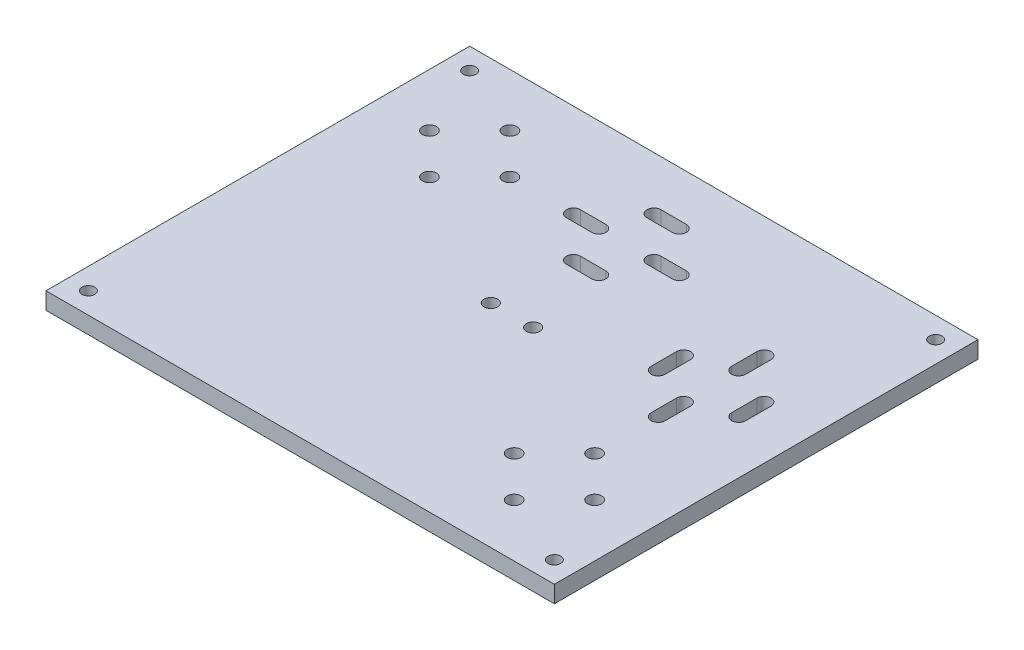
from build123d import *

# Parameters (mm, degrees)
SKETCH2_W           = 120
SKETCH2_H           = 100
BOSS_EXTRUDE1_DEPTH = 4
SKETCH3_R           = 1.5
CUT_EXTRUDE1_DEPTH  = 5
SKETCH4_R           = 1.65
CUT_EXTRUDE2_DEPTH  = 5
SKETCH6_R           = 1.6
CUT_EXTRUDE3_DEPTH  = 5
CUT_EXTRUDE4_DEPTH  = 21


with BuildPart() as part:
    # Sketch2 → Boss-Extrude1 (new body)
    with BuildSketch(Plane(origin=(0, 0, 0), x_dir=(1, 0, 0), z_dir=(0, 1, 0))):
        Rectangle(SKETCH2_W, SKETCH2_H)
    extrude(amount=BOSS_EXTRUDE1_DEPTH)

    # Sketch3 → Cut-Extrude1 (cut)
    with BuildSketch(Plane(origin=(0, 4, 0), x_dir=(1, 0, 0), z_dir=(0, 1, 0))):
        with Locations(Location((-55, 45, 0), (0, 0, 270))):
            Circle(SKETCH3_R)
        with Locations(Location((55, 45, 0), (0, 0, 270))):
            Circle(SKETCH3_R)
        with Locations(Location((55, -45, 0), (0, 0, 270))):
            Circle(SKETCH3_R)
        with Locations(Location((-55, -45, 0), (0, 0, 270))):
            Circle(SKETCH3_R)
    extrude(amount=-CUT_EXTRUDE1_DEPTH, mode=Mode.SUBTRACT)

    # Sketch4 → Cut-Extrude2 (cut)
    with BuildSketch(Plane(origin=(0, 4, 0), x_dir=(1, 0, 0), z_dir=(0, 1, 0))):
        with Locations(Location((-38, 37.5, 0), (0, 0, 270))):
            Circle(SKETCH4_R)
        with Locations(Location((-4, 37.5, 0), (0, 0, 270))):
            Circle(SKETCH4_R)
        with Locations(Location((38, 15.5, 0), (0, 0, 270))):
            Circle(SKETCH4_R)
        with Locations(Location((38, -18.5, 0), (0, 0, 270))):
            Circle(SKETCH4_R)
        with Locations(Location((-28.5, 28, 0), (0, 0, 270))):
            Circle(SKETCH4_R)
        with Locations(Location((-38, 18.5, 0), (0, 0, 270))):
            Circle(SKETCH4_R)
        with Locations(Location((-47.5, 28, 0), (0, 0, 270))):
            Circle(SKETCH4_R)
        with Locations(Location((5.5, 28, 0), (0, 0, 270))):
            Circle(SKETCH4_R)
        with Locations(Location((-4, 18.5, 0), (0, 0, 270))):
            Circle(SKETCH4_R)
        with Locations(Location((-13.5, 28, 0), (0, 0, 270))):
            Circle(SKETCH4_R)
        with Locations(Location((47.5, 6, 0), (0, 0, 270))):
            Circle(SKETCH4_R)
        with Locations(Location((38, -3.5, 0), (0, 0, 270))):
            Circle(SKETCH4_R)
        with Locations(Location((28.5, 6, 0), (0, 0, 270))):
            Circle(SKETCH4_R)
        with Locations(Location((47.5, -28, 0), (0, 0, 270))):
            Circle(SKETCH4_R)
        with Locations(Location((38, -37.5, 0), (0, 0, 270))):
            Circle(SKETCH4_R)
        with Locations(Location((28.5, -28, 0), (0, 0, 270))):
            Circle(SKETCH4_R)
    extrude(amount=-CUT_EXTRUDE2_DEPTH, mode=Mode.SUBTRACT)

    # Sketch6 → Cut-Extrude3 (cut)
    with BuildSketch(Plane(origin=(0, 4, 0), x_dir=(1, 0, 0), z_dir=(0, 1, 0))):
        with Locations(Location((5, 0, 0), (0, 0, 270))):
            Circle(SKETCH6_R)
        with Locations(Location((-5, 0, 0), (0, 0, 270))):
            Circle(SKETCH6_R)
    extrude(amount=-CUT_EXTRUDE3_DEPTH, mode=Mode.SUBTRACT)

    # Sketch7 → Cut-Extrude4 (cut)
    with BuildSketch(Plane(origin=(0, 4, 0), x_dir=(1, 0, 0), z_dir=(0, 1, 0))):
        with BuildLine():
            Line((-4, 39.15), (2, 39.15))
            ThreePointArc((2, 39.15), (3.65, 37.5), (2, 35.85))
            Line((2, 35.85), (-4, 35.85))
            ThreePointArc((-4, 35.85), (-5.65, 37.5), (-4, 39.15))
        make_face()
        with BuildLine():
            Line((5.5, 29.65), (11.5, 29.65))
            ThreePointArc((11.5, 29.65), (13.15, 28), (11.5, 26.35))
            Line((11.5, 26.35), (5.5, 26.35))
            ThreePointArc((5.5, 26.35), (3.85, 28), (5.5, 29.65))
        make_face()
        with BuildLine():
            Line((-4, 20.15), (2, 20.15))
            ThreePointArc((2, 20.15), (3.65, 18.5), (2, 16.85))
            Line((2, 16.85), (-4, 16.85))
            ThreePointArc((-4, 16.85), (-5.65, 18.5), (-4, 20.15))
        make_face()
        with BuildLine():
            Line((-13.5, 29.65), (-7.5, 29.65))
            ThreePointArc((-7.5, 29.65), (-5.85, 28), (-7.5, 26.35))
            Line((-7.5, 26.35), (-13.5, 26.35))
            ThreePointArc((-13.5, 26.35), (-15.15, 28), (-13.5, 29.65))
        make_face()
        with BuildLine():
            Line((36.35, 15.5), (36.35, 21.5))
            ThreePointArc((36.35, 21.5), (38, 23.15), (39.65, 21.5))
            Line((39.65, 21.5), (39.65, 15.5))
            ThreePointArc((39.65, 15.5), (38, 13.85), (36.35, 15.5))
        make_face()
        with BuildLine():
            Line((45.85, 6), (45.85, 12))
            ThreePointArc((45.85, 12), (47.5, 13.65), (49.15, 12))
            Line((49.15, 12), (49.15, 6))
            ThreePointArc((49.15, 6), (47.5, 4.35), (45.85, 6))
        make_face()
        with BuildLine():
            Line((36.35, -3.5), (36.35, 2.5))
            ThreePointArc((36.35, 2.5), (38, 4.15), (39.65, 2.5))
            Line((39.65, 2.5), (39.65, -3.5))
            ThreePointArc((39.65, -3.5), (38, -5.15), (36.35, -3.5))
        make_face()
        with BuildLine():
            Line((26.85, 6), (26.85, 12))
            ThreePointArc((26.85, 12), (28.5, 13.65), (30.15, 12))
            Line((30.15, 12), (30.15, 6))
            ThreePointArc((30.15, 6), (28.5, 4.35), (26.85, 6))
        make_face()
    extrude(amount=-CUT_EXTRUDE4_DEPTH, mode=Mode.SUBTRACT)


solid = part.part
